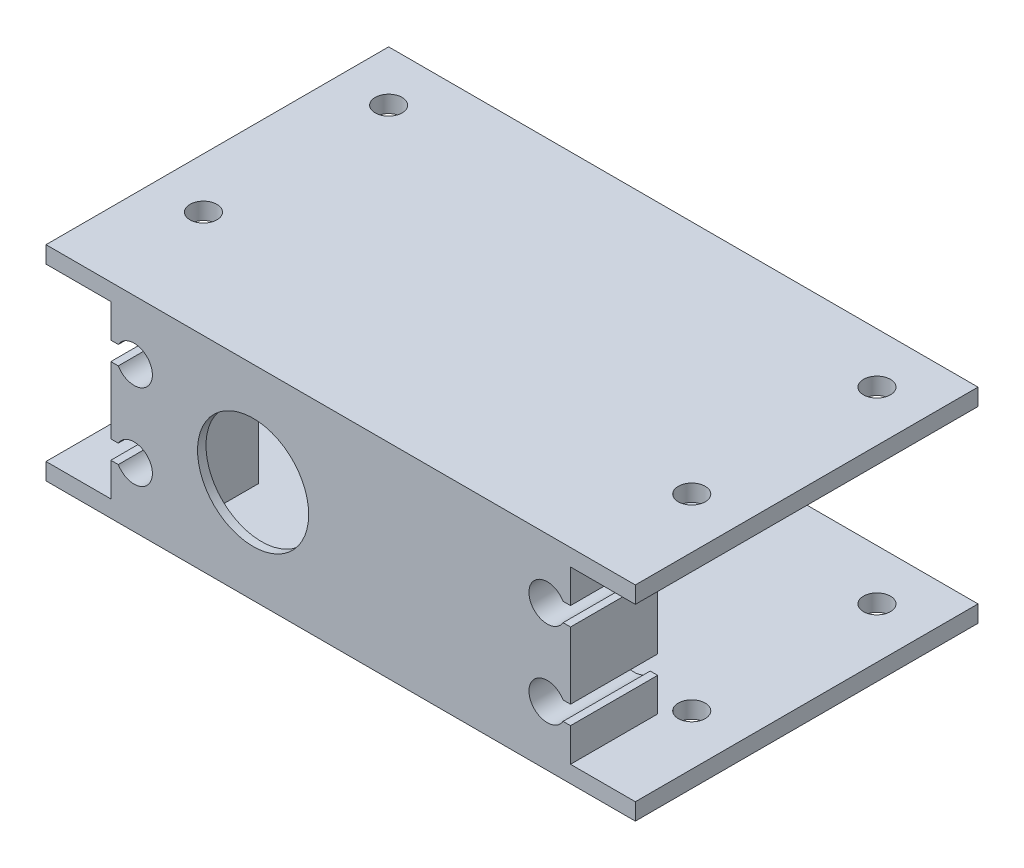
from build123d import *

# Parameters (mm, degrees)
SKETCH1_W             = 40.2
SKETCH1_H             = 2
BOSS_EXTRUDE1_DEPTH   = 40.7
BOSS_EXTRUDE1_2_DEPTH = 40.7
BOSS_EXTRUDE3_START   = 40.7
SKETCH1_3_R           = 6.6
BOSS_EXTRUDE3_DEPTH   = 1
BOSS_EXTRUDE2_START   = -1
BOSS_EXTRUDE2_DEPTH   = 10.35
SKETCH4_R             = 1.6
BOSS_EXTRUDE4_DEPTH   = 2
BOSS_EXTRUDE5_START   = -22.3
SKETCH4_3_W           = 70
SKETCH4_3_H           = 40.7
SKETCH4_3_R           = 1.6
BOSS_EXTRUDE5_DEPTH   = 2


with BuildPart() as part:
    # Sketch1 → Boss-Extrude1 (new body)
    with BuildSketch(Plane.XY):
        with Locations((20.1, 23.3)):
            Rectangle(SKETCH1_W, SKETCH1_H)
    extrude(amount=BOSS_EXTRUDE1_DEPTH)



with BuildPart() as body_2:
    # Sketch1 → Boss-Extrude1 2 (new body)
    with BuildSketch(Plane.XY):
        Polygon((0, 2), (0, 0), (40.2, 0), (40.2, 2), (40.1, 2), (0.1, 2), align=None)
    extrude(amount=BOSS_EXTRUDE1_2_DEPTH)


with BuildPart() as part_1:
    add(part.part)

    add(body_2.part)  # Boss-Extrude3 merges body 2
    # Sketch1<3> → Boss-Extrude3 (add)
    with BuildSketch(Plane.XY.offset(BOSS_EXTRUDE3_START)):
        Polygon((0, 22.3), (0, 2), (0.1, 2), (40.1, 2), (40.2, 2), (40.2, 22.3), align=None)
        with Locations((9.7, 12.15)):
            Circle(SKETCH1_3_R, mode=Mode.SUBTRACT)
    extrude(amount=-BOSS_EXTRUDE3_DEPTH)

    # Sketch3 → Boss-Extrude2 (add)
    with BuildSketch(Plane(origin=(0, -15.7, 39.7), x_dir=(1, 0, 0), z_dir=(0, 0, -1)).offset(BOSS_EXTRUDE2_START)):
        with BuildLine():
            ThreePointArc((-6.315, -21.675), (-2.26366714, -22.775), (-6.315, -23.875))
            Line((-6.315, -23.875), (-7.2, -23.875))
            Line((-7.2, -23.875), (-7.2, -31.825))
            Line((-7.2, -31.825), (-6.315, -31.825))
            ThreePointArc((-6.315, -31.825), (-2.26366714, -32.925), (-6.315, -34.025))
            Line((-6.315, -34.025), (-7.2, -34.025))
            Line((-7.2, -34.025), (-7.2, -40))
            Line((-7.2, -40), (0, -40))
            Line((0, -40), (0, -15.7))
            Line((0, -15.7), (-7.2, -15.7))
            Line((-7.2, -15.7), (-7.2, -21.675))
            Line((-7.2, -21.675), (-6.315, -21.675))
        make_face()
    boss_extrude2 = extrude(amount=BOSS_EXTRUDE2_DEPTH)

    # Mirror1: Boss-Extrude2 across plane
    add(boss_extrude2.mirror(Plane(origin=(20.1, 0, 0), x_dir=(0, 0, 1), z_dir=(1, 0, 0))))

    # Sketch4 → Boss-Extrude4 (add)
    # profile 1 of 2: a face of its own
    with BuildSketch(Plane(origin=(0, 24.3, 0), x_dir=(1, 0, 0), z_dir=(0, 1, 0))):
        Polygon((0, 0), (-14.9, 0), (-14.9, -40.7), (-7.2, -40.7), (-7.2, -30.35), (0, -30.35), align=None)
        with Locations(Location((-8.9, -28, 0), (0, 0, 270))):
            Circle(SKETCH4_R, mode=Mode.SUBTRACT)
        with Locations(Location((-8.9, -6, 0), (0, 0, 270))):
            Circle(SKETCH4_R, mode=Mode.SUBTRACT)
    # profile 2 of 2: a face of its own
    with BuildSketch(Plane(origin=(0, 24.3, 0), x_dir=(1, 0, 0), z_dir=(0, 1, 0))):
        Polygon((55.1, 0), (40.2, 0), (40.2, -30.35), (47.4, -30.35), (47.4, -40.7), (55.1, -40.7), align=None)
        with Locations(Location((49.1, -28, 0), (0, 0, 270))):
            Circle(SKETCH4_R, mode=Mode.SUBTRACT)
        with Locations(Location((49.1, -6, 0), (0, 0, 270))):
            Circle(SKETCH4_R, mode=Mode.SUBTRACT)
    extrude(amount=-BOSS_EXTRUDE4_DEPTH)

    # Sketch4<3> → Boss-Extrude5 (add)
    with BuildSketch(Plane(origin=(0, 24.3, 0), x_dir=(1, 0, 0), z_dir=(0, 1, 0)).offset(BOSS_EXTRUDE5_START)):
        with Locations((20.1, -20.35)):
            Rectangle(SKETCH4_3_W, SKETCH4_3_H)
        with Locations(Location((-8.9, -6, 0), (0, 0, 270))):
            Circle(SKETCH4_3_R, mode=Mode.SUBTRACT)
        with Locations(Location((49.1, -6, 0), (0, 0, 270))):
            Circle(SKETCH4_3_R, mode=Mode.SUBTRACT)
        with Locations(Location((49.1, -28, 0), (0, 0, 270))):
            Circle(SKETCH4_3_R, mode=Mode.SUBTRACT)
        with Locations(Location((-8.9, -28, 0), (0, 0, 270))):
            Circle(SKETCH4_3_R, mode=Mode.SUBTRACT)
    extrude(amount=-BOSS_EXTRUDE5_DEPTH)


solid = part_1.part
